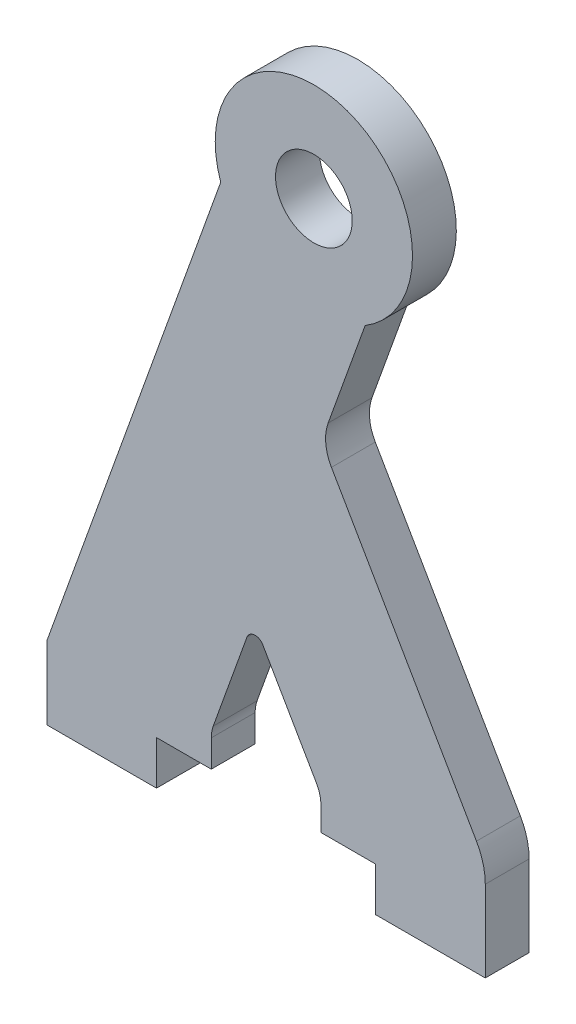
from build123d import *

# Parameters (mm, degrees)
SKETCH1_R           = 1.75
BOSS_EXTRUDE1_DEPTH = 2


with BuildPart() as part:
    # Sketch1 → Boss-Extrude1 (new body)
    with BuildSketch(Plane.XY):
        with BuildLine():
            Line((0, 0), (0, 3.327095189))
            Line((0, 3.327095189), (7.929895835, 25.403579408))
            ThreePointArc((7.929895835, 25.403579408), (13.70124174, 31.117370669), (14.517783542, 23.037203368))
            Line((14.517783542, 23.037203368), (12.831302958, 18.342114962))
            ThreePointArc((12.831302958, 18.342114962), (12.721539225, 17.487494723), (12.981505781, 16.666007522))
            Line((12.981505781, 16.666007522), (19.598076211, 5.205771366))
            ThreePointArc((19.598076211, 5.205771366), (19.897777479, 4.482228501), (20, 3.705771366))
            Line((20, 3.705771366), (20, 0))
            Line((20, 0), (15, 0))
            Line((15, 0), (15, 2))
            Line((15, 2), (12.5, 2))
            Line((12.5, 2), (12.5, 3.098076211))
            ThreePointArc((12.5, 3.098076211), (12.448888739, 3.486304779), (12.299038106, 3.848076211))
            Line((12.299038106, 3.848076211), (9.848953011, 8.091748078))
            ThreePointArc((9.848953011, 8.091748078), (9.46684029, 8.290151551), (9.126092124, 8.026969566))
            Line((9.126092124, 8.026969566), (7.588309777, 3.745850569))
            ThreePointArc((7.588309777, 3.745850569), (7.522242352, 3.49612642), (7.5, 3.238769989))
            Line((7.5, 3.238769989), (7.5, 2))
            Line((7.5, 2), (5, 2))
            Line((5, 2), (5, 0))
            Line((5, 0), (0, 0))
        make_face()
        with Locations((12.18, 26.8823)):
            Circle(SKETCH1_R, mode=Mode.SUBTRACT)
    extrude(amount=BOSS_EXTRUDE1_DEPTH)


solid = part.part
